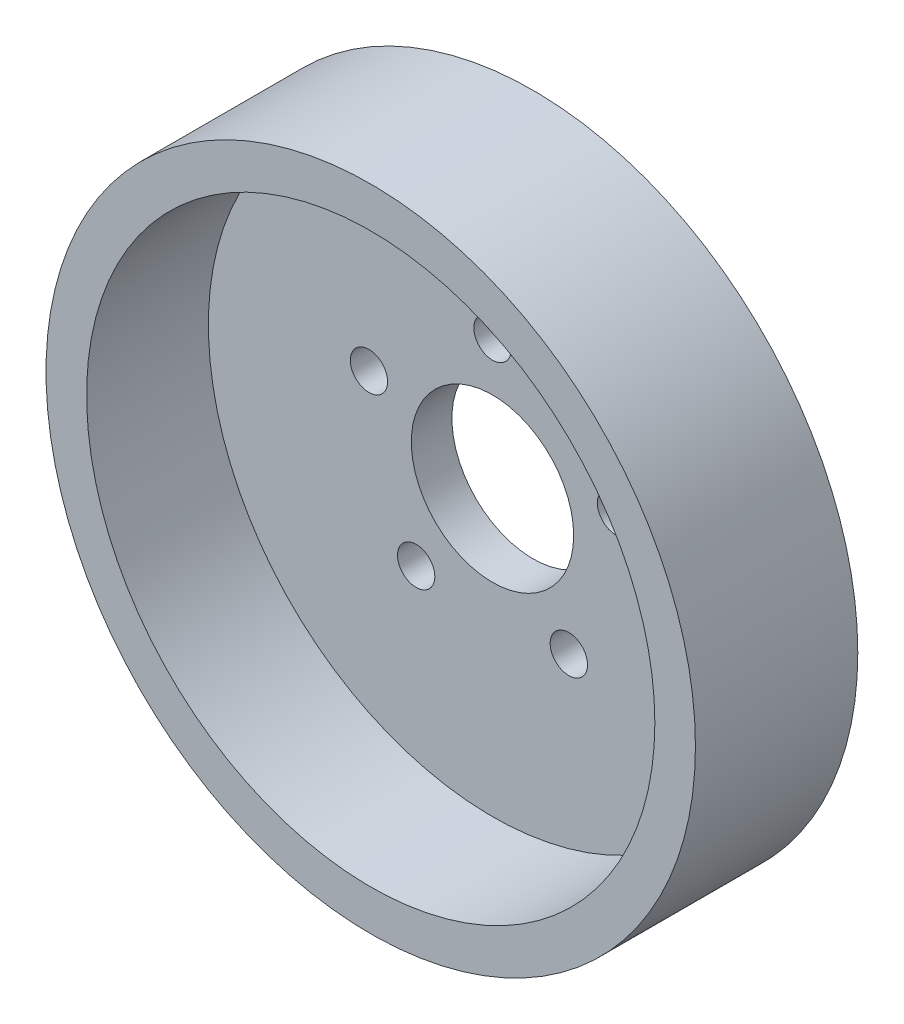
from build123d import *

# Parameters (mm, degrees)
SKETCH1_R           = 50.8
SKETCH1_R_2         = 12.7
SKETCH1_R_3         = 2.921
BOSS_EXTRUDE2_DEPTH = 25.4
SKETCH2_R           = 44.45
CUT_EXTRUDE1_DEPTH  = 19.05


with BuildPart() as part:
    # Sketch1 → Boss-Extrude2 (new body)
    with BuildSketch(Plane.XY):
        Circle(SKETCH1_R)
        Circle(SKETCH1_R_2, mode=Mode.SUBTRACT)
        with Locations((0, 20.32)):
            Circle(SKETCH1_R_3, mode=Mode.SUBTRACT)
        with Locations((19.325468411, 6.279225326)):
            Circle(SKETCH1_R_3, mode=Mode.SUBTRACT)
        with Locations((11.943796327, -16.439225326)):
            Circle(SKETCH1_R_3, mode=Mode.SUBTRACT)
        with Locations((-11.943796327, -16.439225326)):
            Circle(SKETCH1_R_3, mode=Mode.SUBTRACT)
        with Locations((-19.325468411, 6.279225326)):
            Circle(SKETCH1_R_3, mode=Mode.SUBTRACT)
    extrude(amount=BOSS_EXTRUDE2_DEPTH)

    # Sketch2 → Cut-Extrude1 (cut)
    with BuildSketch(Plane.XY.offset(25.4)):
        Circle(SKETCH2_R)
    extrude(amount=-CUT_EXTRUDE1_DEPTH, mode=Mode.SUBTRACT)


solid = part.part
